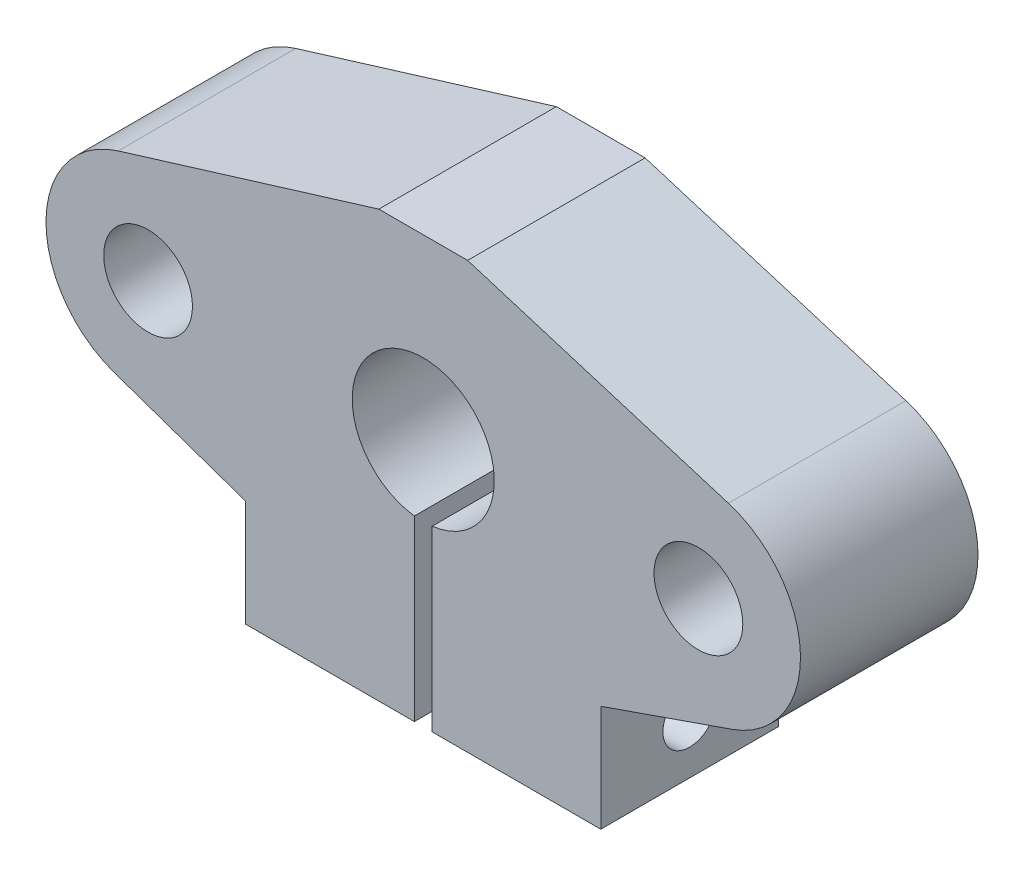
from build123d import *

# Parameters (mm, degrees)
SKETCH_1_R          = 2.5
EXTRUDE_1_DEPTH     = 10
SKETCH_2_R          = 1.5
CUT_EXTRUDE_1_DEPTH = 35.936549629


with BuildPart() as part:
    # 草图1 → 凸台-拉伸1 (new body)
    with BuildSketch(Plane.XY):
        with BuildLine():
            Line((0.5, -12), (10, -12))
            Line((10, -12), (10, -6))
            Line((10, -6), (17.388376345, -3.431071237))
            ThreePointArc((17.388376345, -3.431071237), (21.249009569, 2.10671914), (17.185510359, 7.497413467))
            Line((17.185510359, 7.497413467), (2.5, 12))
            Line((2.5, 12), (-2.5, 12))
            Line((-2.5, 12), (-17.185510359, 7.497413467))
            ThreePointArc((-17.185510359, 7.497413467), (-20.123536772, 5.418392563), (-21.25, 2))
            ThreePointArc((-21.25, 2), (-20.186185228, -1.331991598), (-17.388376345, -3.431071237))
            Line((-17.388376345, -3.431071237), (-10, -6))
            Line((-10, -6), (-10, -12))
            Line((-10, -12), (-0.5, -12))
            Line((-0.5, -12), (-0.5, -6))
            Line((-0.5, -6), (-0.5, -1.968626967))
            ThreePointArc((-0.5, -1.968626967), (0, 6), (0.5, -1.968626967))
            Line((0.5, -1.968626967), (0.5, -6))
            Line((0.5, -6), (0.5, -12))
        make_face()
        with Locations((-15.5, 2)):
            Circle(SKETCH_1_R, mode=Mode.SUBTRACT)
        with Locations((15.5, 2)):
            Circle(SKETCH_1_R, mode=Mode.SUBTRACT)
    extrude(amount=EXTRUDE_1_DEPTH)

    # 草图2 → 切除-拉伸1 (cut, through all)
    with BuildSketch(Plane(origin=(10, 0, 0), x_dir=(0, 0, -1), z_dir=(1, 0, 0))):
        with Locations((-5, -9)):
            Circle(SKETCH_2_R)
    extrude(amount=-CUT_EXTRUDE_1_DEPTH, mode=Mode.SUBTRACT)


solid = part.part
